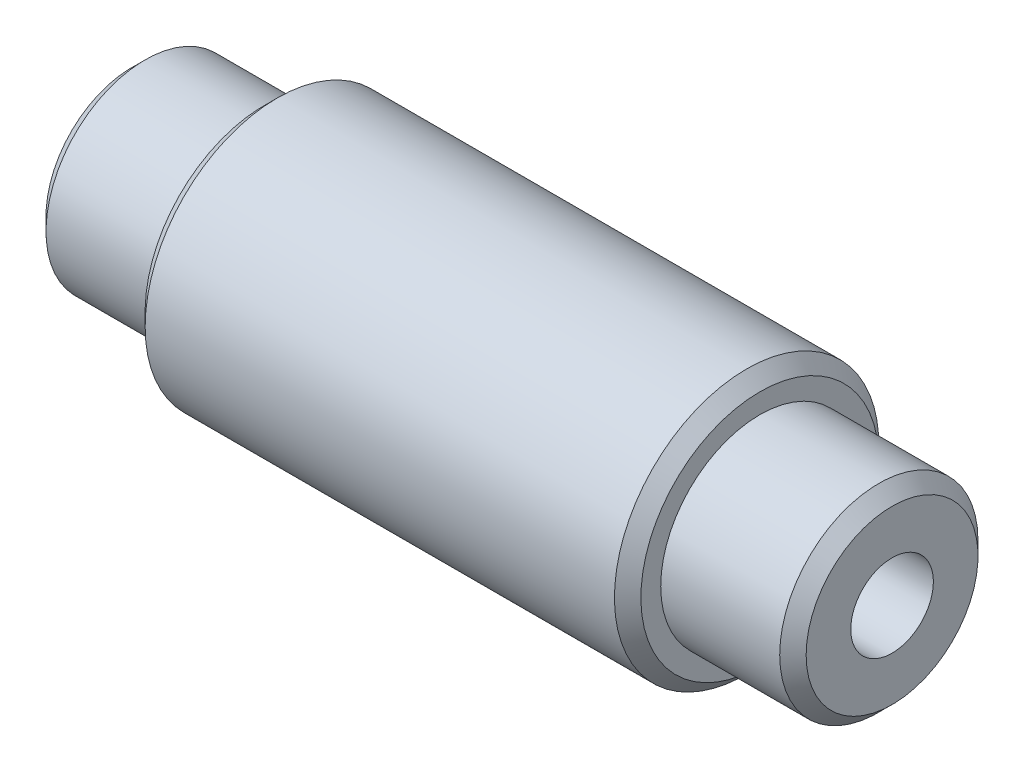
from build123d import *

# Parameters (mm, degrees)
SKETCH1_W          = 15
SKETCH1_H          = 4
CHAMFER1_SIZE      = 0.4
SKETCH2_W          = 23
SKETCH2_H          = 3
TAPPED_HOLE1_D     = 2.5
TAPPED_HOLE1_DEPTH = 8.5
TAPPED_HOLE1_TIP   = 0.751075774
TAPPED_HOLE2_D     = 2.5
TAPPED_HOLE2_DEPTH = 8.5
TAPPED_HOLE2_TIP   = 0.751075774
CHAMFER2_SIZE      = 0.4
CHAMFER3_SIZE      = 0.4


with BuildPart() as part:
    # Sketch1 → Revolve1 (revolve)
    with BuildSketch(Plane.XY):
        with Locations((7.5, 2)):
            Rectangle(SKETCH1_W, SKETCH1_H)
    revolve(axis=Axis((15, 0, 0), (-1, 0, 0)))

    # Chamfer1
    chamfer1_edges = [part.edges().sort_by_distance(p)[0] for p in [
        (15, -4, 0),
        (0, -4, 0),
    ]]
    chamfer(chamfer1_edges, length=CHAMFER1_SIZE)

    # Sketch2 → Revolve2 (revolve)
    with BuildSketch(Plane.XY, mode=Mode.PRIVATE) as revolve2_sk:
        with Locations((7.5, 1.5)):
            Rectangle(SKETCH2_W, SKETCH2_H)
    revolve(revolve2_sk.sketch.rotate(Axis((-4, 0, 0), (1, 0, 0)), 90), axis=Axis((-4, 0, 0), (1, 0, 0)))

    # Tapped Hole1
    with Locations(Plane(origin=(-4, 0, 0), x_dir=(0, 0, -1), z_dir=(-1, 0, 0))):
        with Locations((0, 0)):
            Hole(TAPPED_HOLE1_D / 2, depth=TAPPED_HOLE1_DEPTH)
            with Locations((0, 0, -(TAPPED_HOLE1_DEPTH + TAPPED_HOLE1_TIP / 2))):  # 118° drill point
                Cone(0, TAPPED_HOLE1_D / 2, TAPPED_HOLE1_TIP, mode=Mode.SUBTRACT)

    # Tapped Hole2
    with Locations(Plane(origin=(19, 1.854743126, 0.460903034), x_dir=(0, 0, -1), z_dir=(1, 0, 0))):
        with Locations((0.460903034, -1.854743126)):
            Hole(TAPPED_HOLE2_D / 2, depth=TAPPED_HOLE2_DEPTH)
            with Locations((0, 0, -(TAPPED_HOLE2_DEPTH + TAPPED_HOLE2_TIP / 2))):  # 118° drill point
                Cone(0, TAPPED_HOLE2_D / 2, TAPPED_HOLE2_TIP, mode=Mode.SUBTRACT)

    # Chamfer2
    chamfer2_edges = [part.edges().sort_by_distance(p)[0] for p in [
        (-4, 0, -3),
    ]]
    chamfer(chamfer2_edges, length=CHAMFER2_SIZE)

    # Chamfer3
    chamfer3_edges = [part.edges().sort_by_distance(p)[0] for p in [
        (19, 0, -3),
    ]]
    chamfer(chamfer3_edges, length=CHAMFER3_SIZE)


solid = part.part
